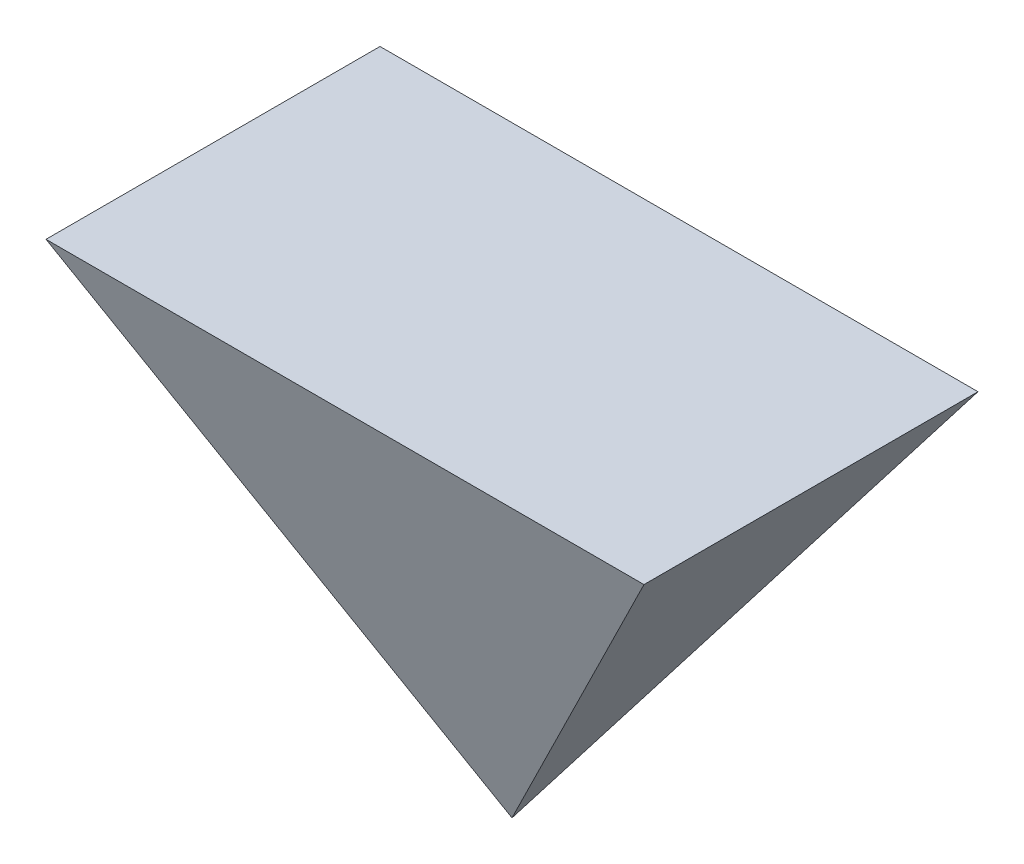
from build123d import *


with BuildPart() as part:
    # StartSquare → Frustum section 0
    with BuildSketch(Plane(origin=(0, 0, 0), x_dir=(1, 0, 0), z_dir=(0, 1, 0))):
        with BuildLine():
            Line((-1.3644, 0.7749), (1.3644, 0.7749))
            Line((1.3644, 0.7749), (1.3644, -0.7749))
            Line((1.3644, -0.7749), (-1.3644, -0.7749))
            Line((-1.3644, -0.7749), (-1.3644, 0.7749))
        make_face()
    # EndSquare → Frustum section 1
    with BuildSketch(Plane(origin=(0, 1500, 0), x_dir=(1, 0, 0), z_dir=(0, 1, 0))):
        with BuildLine():
            Line((-1032.285838, 576.5709526), (1032.285838, 576.5709526))
            Line((1032.285838, 576.5709526), (1032.285838, -576.5709526))
            Line((1032.285838, -576.5709526), (-1032.285838, -576.5709526))
            Line((-1032.285838, -576.5709526), (-1032.285838, 576.5709526))
        make_face()
    loft()


solid = part.part
